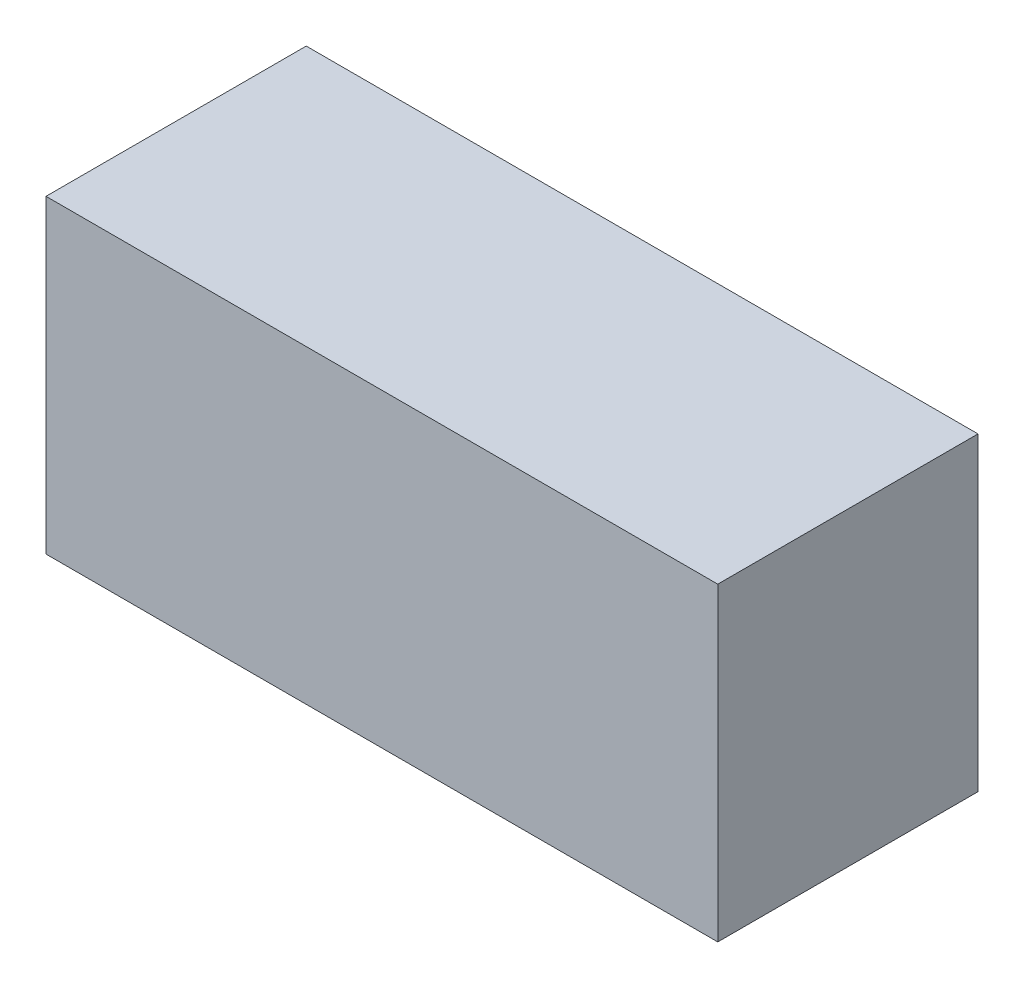
from build123d import *

# Parameters (mm, degrees)
SKETCH1_W           = 55.5
SKETCH1_H           = 25.6
SKETCH1_R           = 10
SKETCH1_W_2         = 5
SKETCH1_H_2         = 20
BOSS_EXTRUDE1_DEPTH = 21.5
BOSS_EXTRUDE2_START = 3
SKETCH1_2_W         = 5
SKETCH1_2_H         = 20
SKETCH1_2_R         = 10
BOSS_EXTRUDE2_DEPTH = 18.5


with BuildPart() as part:
    # Sketch1 → Boss-Extrude1 (new body)
    with BuildSketch(Plane.XY):
        Rectangle(SKETCH1_W, SKETCH1_H)
        with Locations((15.75, 0)):
            Circle(SKETCH1_R, mode=Mode.SUBTRACT)
        with Locations((-22.25, 0)):
            Rectangle(SKETCH1_W_2, SKETCH1_H_2, mode=Mode.SUBTRACT)
    extrude(amount=BOSS_EXTRUDE1_DEPTH)

    # Sketch1<2> → Boss-Extrude2 (add)
    with BuildSketch(Plane.XY.offset(BOSS_EXTRUDE2_START)):
        with Locations((-22.25, 0)):
            Rectangle(SKETCH1_2_W, SKETCH1_2_H)
        with Locations(Location((15.75, 0, 0), (0, 0, 180))):
            Circle(SKETCH1_2_R)
    extrude(amount=BOSS_EXTRUDE2_DEPTH)


solid = part.part
